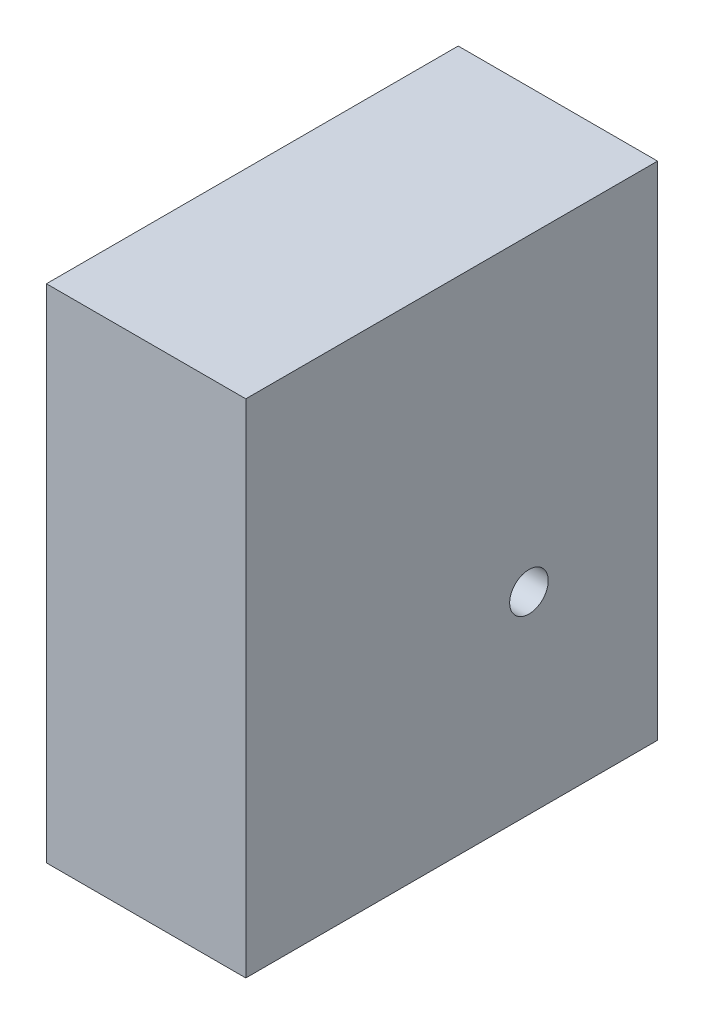
from build123d import *

# Parameters (mm, degrees)
SKETCH1_W               = 155
SKETCH1_H               = 390
BOSS_EXTRUDE1_DEPTH     = 320.16
SKETCH2_W               = 100
SKETCH2_H               = 100
CUT_EXTRUDE1_DEPTH      = 150
CUT_EXTRUDE2_DEPTH      = 406.650620115
CUT_EXTRUDE2_DEPTH_BACK = 406.650620115
SKETCH3_R               = 15


with BuildPart() as part:
    # Sketch1 → Boss-Extrude1 (new body)
    with BuildSketch(Plane.XY):
        Rectangle(SKETCH1_W, SKETCH1_H)
    extrude(amount=BOSS_EXTRUDE1_DEPTH)

    # Sketch2 → Cut-Extrude1 (cut)
    with BuildSketch(Plane(origin=(0, 0, 0), x_dir=(-1, 0, 0), z_dir=(0, 0, -1))):
        with Locations((0, -45)):
            Rectangle(SKETCH2_W, SKETCH2_H)
    extrude(amount=-CUT_EXTRUDE1_DEPTH, mode=Mode.SUBTRACT)

    # Sketch3 → Cut-Extrude2 (cut, two sides: drawn at the far end of the back side and taken through both)
    with BuildSketch(Plane(origin=(77.5, 0, 0), x_dir=(0, 0, -1), z_dir=(1, 0, 0)).offset(-CUT_EXTRUDE2_DEPTH_BACK)):
        with Locations(Location((-100, -45, 0), (0, 0, 90))):
            Circle(SKETCH3_R)
    extrude(amount=CUT_EXTRUDE2_DEPTH + CUT_EXTRUDE2_DEPTH_BACK, mode=Mode.SUBTRACT)


solid = part.part
